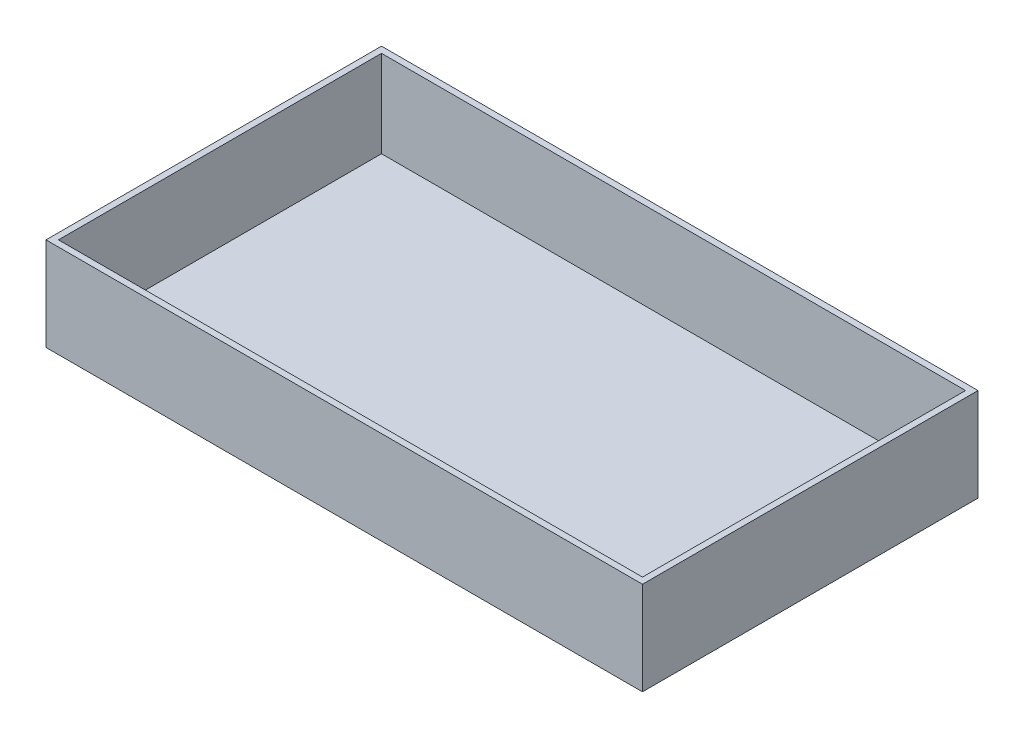
from build123d import *

# Parameters (mm, degrees)
SKETCH_1_W      = 480
SKETCH_1_H      = 270
EXTRUDE_1_DEPTH = 75
SHELL_1_T       = -5


with BuildPart() as part:
    # ｽｹｯﾁ1 → ﾎﾞｽ - 押し出し1 (new body)
    with BuildSketch(Plane(origin=(0, 0, 0), x_dir=(1, 0, 0), z_dir=(0, 1, 0))):
        Rectangle(SKETCH_1_W, SKETCH_1_H)
    extrude(amount=EXTRUDE_1_DEPTH)

    # ｼｪﾙ1
    shell_1_openings = [part.faces().sort_by_distance(p)[0] for p in [
        (0, 75, 0),
    ]]
    offset(amount=SHELL_1_T, openings=shell_1_openings, kind=Kind.INTERSECTION)


solid = part.part
